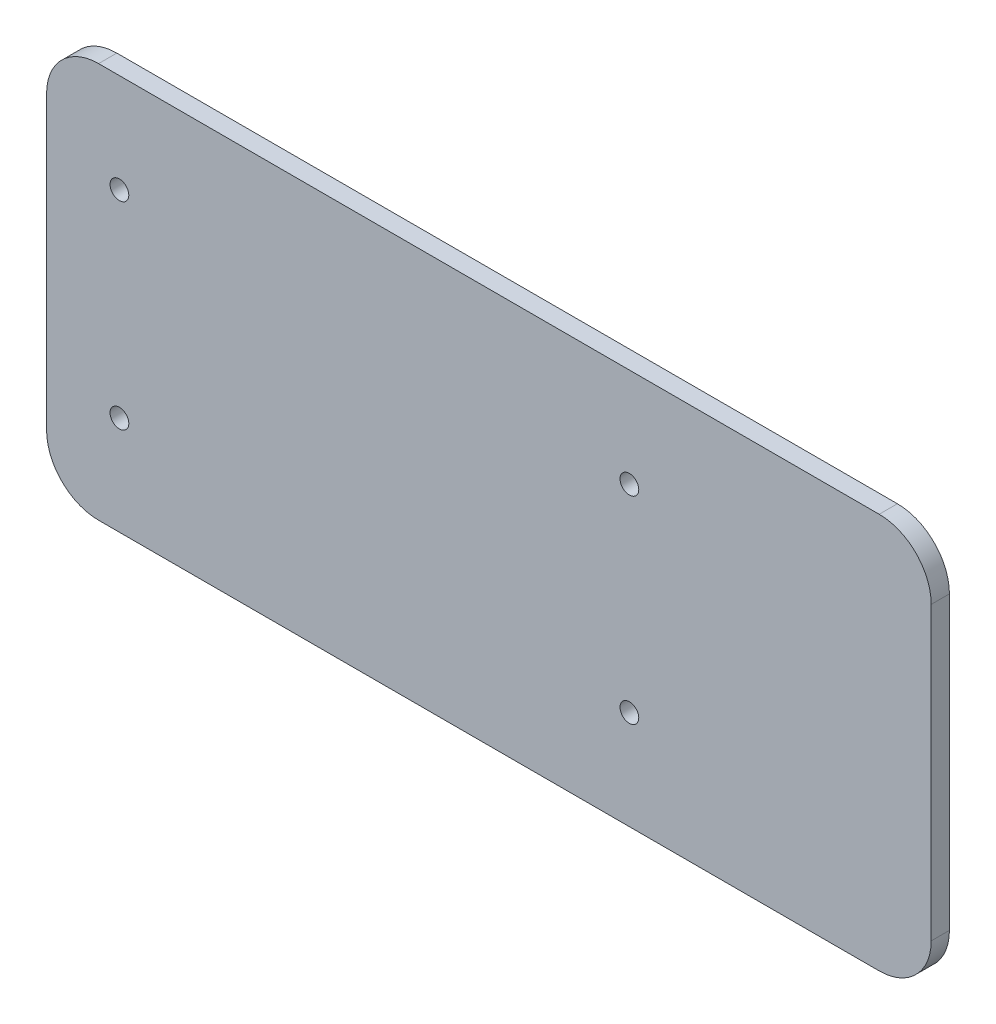
from build123d import *

# Parameters (mm, degrees)
SKETCH_1_W               = 170
SKETCH_1_H               = 76
EXTRUDE_1_DEPTH          = 3.5
FILLET_1_R               = 10
SKETCH_2_W               = 8
SKETCH_2_H               = 20
CUT_EXTRUDE_1_DEPTH      = 3
SKETCH_3_W               = 8
SKETCH_3_H               = 20
CUT_EXTRUDE_2_DEPTH      = 3
SKETCH_6_R               = 1.8
CUT_EXTRUDE_4_DEPTH      = 4
MIRROR_2_COPY_1_SKETCH_R = 1.8
MIRROR_2_COPY_1_DEPTH    = 4


with BuildPart() as part:
    # 草图1 → 凸台-拉伸1 (new body)
    with BuildSketch(Plane.XY):
        Rectangle(SKETCH_1_W, SKETCH_1_H)
    extrude(amount=EXTRUDE_1_DEPTH)

    # 圆角1
    fillet_1_edges = [part.edges().sort_by_distance(p)[0] for p in [
        (-85, 38, 1.75),
        (-85, -38, 1.75),
        (85, -38, 1.75),
        (85, 38, 1.75),
    ]]
    fillet(fillet_1_edges, radius=FILLET_1_R)

    # 草图2 → 切除-拉伸1 (cut)
    with BuildSketch(Plane(origin=(0, 0, 0), x_dir=(-1, 0, 0), z_dir=(0, 0, -1))):
        with Locations((-27, 0)):
            Rectangle(SKETCH_2_W, SKETCH_2_H)
    extrude(amount=-CUT_EXTRUDE_1_DEPTH, mode=Mode.SUBTRACT)

    # 草图3 → 切除-拉伸2 (cut)
    with BuildSketch(Plane(origin=(0, 0, 0), x_dir=(-1, 0, 0), z_dir=(0, 0, -1))):
        with Locations((71, 0)):
            Rectangle(SKETCH_3_W, SKETCH_3_H)
    extrude(amount=-CUT_EXTRUDE_2_DEPTH, mode=Mode.SUBTRACT)

    # 草图6 → 切除-拉伸4 (cut)
    with BuildSketch(Plane(origin=(0, 0, 0), x_dir=(-1, 0, 0), z_dir=(0, 0, -1))):
        with Locations((71, -19)):
            Circle(SKETCH_6_R)
    cut_extrude_4 = extrude(amount=-CUT_EXTRUDE_4_DEPTH, mode=Mode.SUBTRACT)

    # 镜向1: 切除-拉伸4 across plane
    add(cut_extrude_4.mirror(Plane.ZX), mode=Mode.SUBTRACT)

    # 镜向2: 切除-拉伸4 across plane
    add(cut_extrude_4.mirror(Plane(origin=(-22, 0, 0), x_dir=(0, 0, 1), z_dir=(1, 0, 0))), mode=Mode.SUBTRACT)

    # 镜向2 copy 1 sketch → 镜向2 copy 1 (cut)
    with BuildSketch(Plane(origin=(-44, 0, 0), x_dir=(1, 0, 0), z_dir=(0, 0, -1))):
        with Locations((71, -19)):
            Circle(MIRROR_2_COPY_1_SKETCH_R)
    extrude(amount=-MIRROR_2_COPY_1_DEPTH, mode=Mode.SUBTRACT)


solid = part.part
